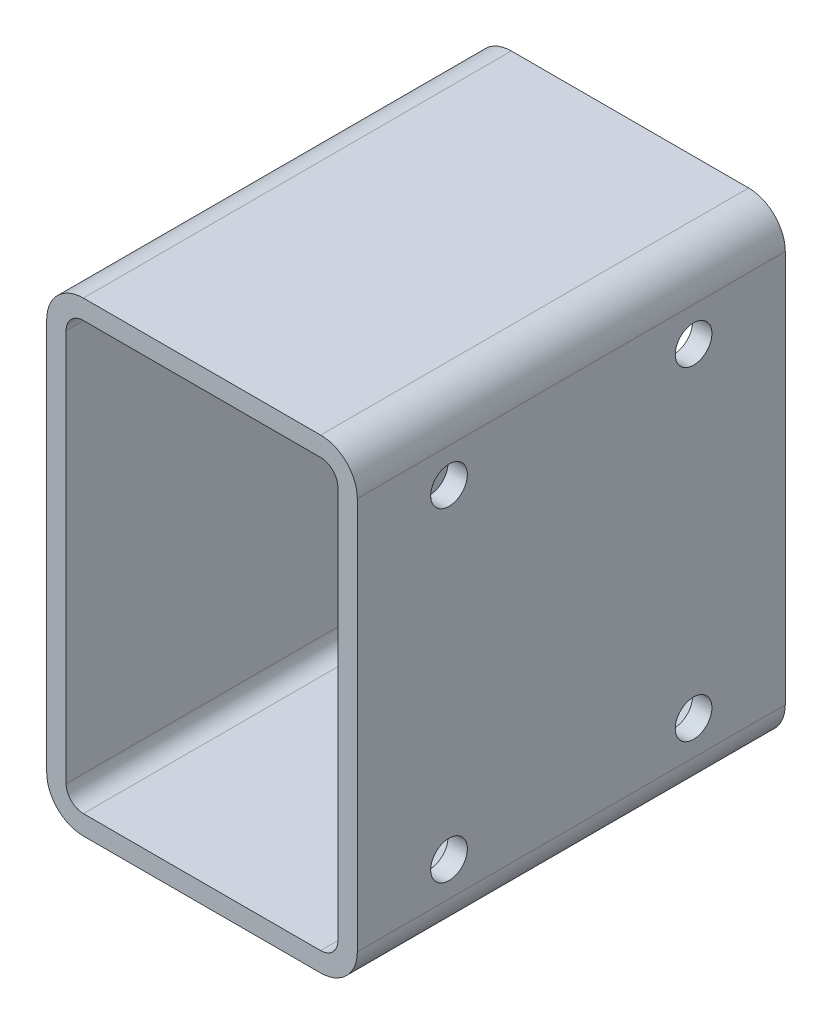
from build123d import *

# Parameters (mm, degrees)
BOSS_EXTRUDE1_DEPTH = 35
SKETCH2_R           = 3
CUT_EXTRUDE1_DEPTH  = 10


with BuildPart() as part:
    # Sketch1 → Boss-Extrude1 (new, symmetric)
    with BuildSketch(Plane.XY):
        with BuildLine():
            Line((19.4, -38.1), (-19.4, -38.1))
            ThreePointArc((-19.4, -38.1), (-23.642640687, -36.342640687), (-25.4, -32.1))
            Line((-25.4, -32.1), (-25.4, 32.1))
            ThreePointArc((-25.4, 32.1), (-23.642640687, 36.342640687), (-19.4, 38.1))
            Line((-19.4, 38.1), (19.4, 38.1))
            ThreePointArc((19.4, 38.1), (23.642640687, 36.342640687), (25.4, 32.1))
            Line((25.4, 32.1), (25.4, -32.1))
            ThreePointArc((25.4, -32.1), (23.642640687, -36.342640687), (19.4, -38.1))
        make_face()
        with BuildLine():
            Line((19.4, 34.925), (-19.4, 34.925))
            ThreePointArc((-19.4, 34.925), (-21.397576657, 34.097576657), (-22.225, 32.1))
            Line((-22.225, 32.1), (-22.225, -32.1))
            ThreePointArc((-22.225, -32.1), (-21.397576657, -34.097576657), (-19.4, -34.925))
            Line((-19.4, -34.925), (19.4, -34.925))
            ThreePointArc((19.4, -34.925), (21.397576657, -34.097576657), (22.225, -32.1))
            Line((22.225, -32.1), (22.225, 32.1))
            ThreePointArc((22.225, 32.1), (21.397576657, 34.097576657), (19.4, 34.925))
        make_face(mode=Mode.SUBTRACT)
    extrude(amount=BOSS_EXTRUDE1_DEPTH, both=True)

    # Sketch2 → Cut-Extrude1 (cut)
    with BuildSketch(Plane(origin=(25.4, 0, 0), x_dir=(0, 0, -1), z_dir=(1, 0, 0))):
        with Locations(Location((-20, 26.5, 0), (0, 0, 90))):
            Circle(SKETCH2_R)
        with Locations(Location((20, 26.5, 0), (0, 0, 90))):
            Circle(SKETCH2_R)
        with Locations(Location((20, -26.5, 0), (0, 0, 90))):
            Circle(SKETCH2_R)
        with Locations(Location((-20, -26.5, 0), (0, 0, 90))):
            Circle(SKETCH2_R)
    extrude(amount=-CUT_EXTRUDE1_DEPTH, mode=Mode.SUBTRACT)


solid = part.part
